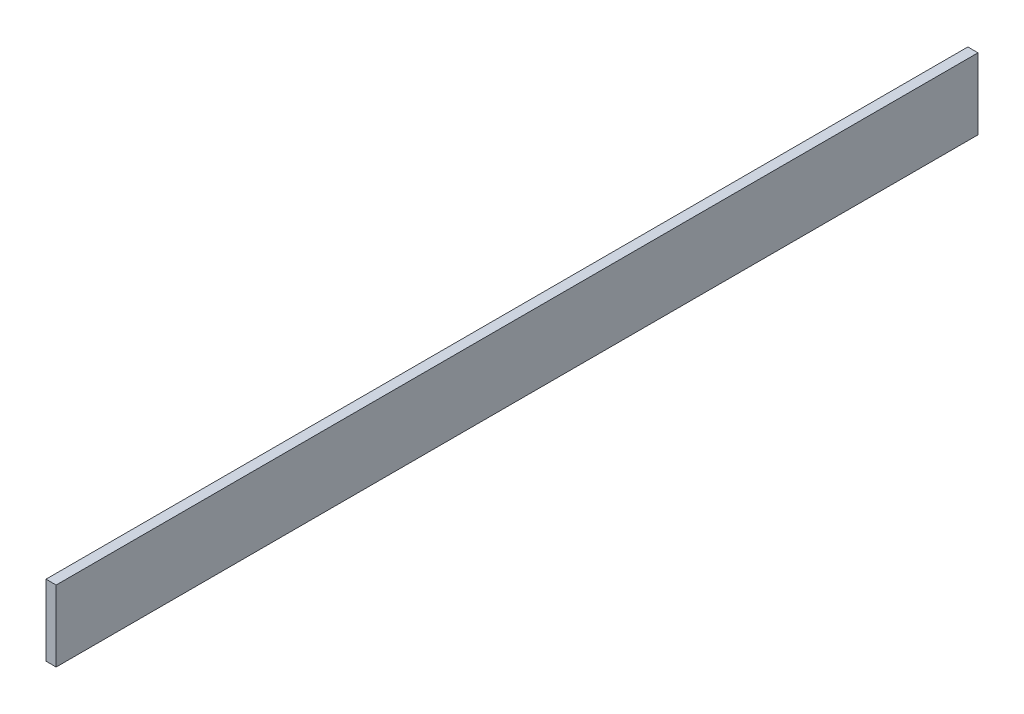
from build123d import *

# Parameters (mm, degrees)
SKETCH1_W           = 3.175
SKETCH1_H           = 22.225
BOSS_EXTRUDE1_DEPTH = 288.29


with BuildPart() as part:
    # Sketch1 → Boss-Extrude1 (new body)
    with BuildSketch(Plane.XY):
        with Locations((1.5875, 11.1125)):
            Rectangle(SKETCH1_W, SKETCH1_H)
    extrude(amount=BOSS_EXTRUDE1_DEPTH)


solid = part.part
